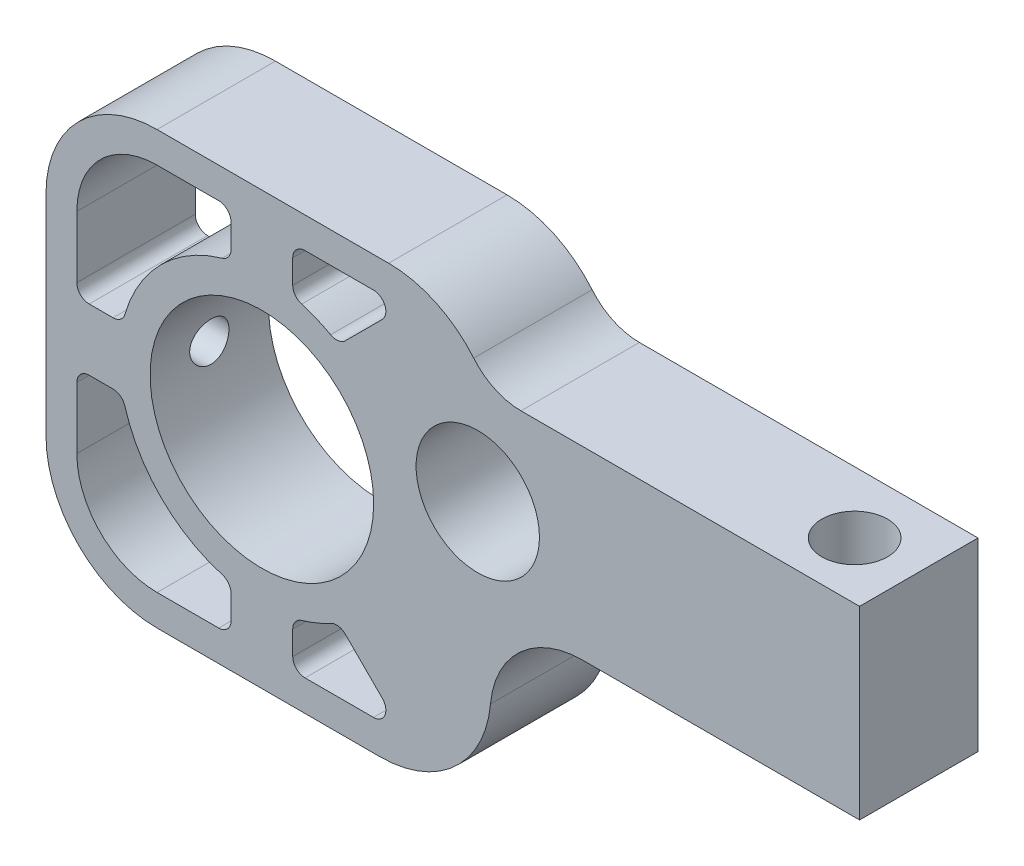
from build123d import *

# Parameters (mm, degrees)
SKETCH1_W               = 96.52
SKETCH1_H               = 44.45
BOSS_EXTRUDE1_DEPTH     = 6.096
CUT_EXTRUDE1_REACH      = 108.961
SKETCH2_R               = 11.50874
CUT_EXTRUDE2_REACH      = 108.438
SKETCH3_R               = 3.3782
CUT_EXTRUDE3_REACH      = 108.961
SKETCH7_W               = 12.7635
SKETCH7_H               = 12.192
CUT_EXTRUDE5_DEPTH      = 104.946532487
FILLET1_R               = 11.43
CUT_EXTRUDE9_REACH      = 97.016
CUT_EXTRUDE9_END_RADIUS = 11.50874
SKETCH11_R              = 2.0193
SKETCH12_R              = 6.35
CUT_EXTRUDE10_DEPTH     = 96.601248341


with BuildPart() as part:
    # Sketch1 → Boss-Extrude1 (new, symmetric)
    with BuildSketch(Plane.XY):
        with Locations((48.26, -22.225)):
            Rectangle(SKETCH1_W, SKETCH1_H)
    extrude(amount=BOSS_EXTRUDE1_DEPTH, both=True)

    # Sketch2 → Cut-Extrude1 (cut, up to next)
    with BuildSketch(Plane.XY.offset(6.096), mode=Mode.PRIVATE) as cut_extrude1_sk1:
        with Locations((22.225, -22.225)):
            Circle(SKETCH2_R)
    cut_extrude1_tool1 = extrude(cut_extrude1_sk1.sketch, amount=-CUT_EXTRUDE1_REACH, mode=Mode.PRIVATE) & part.part
    add(cut_extrude1_tool1.solids().sort_by_distance((22.225, -22.225, 6.096))[0], mode=Mode.SUBTRACT)

    # Sketch3 → Cut-Extrude2 (cut, up to next)
    with BuildSketch(Plane(origin=(0, 0, 0), x_dir=(1, 0, 0), z_dir=(0, 1, 0)), mode=Mode.PRIVATE) as cut_extrude2_sk1:
        with Locations(Location((77.4065, -0.254, 0), (0, 0, 270))):
            Circle(SKETCH3_R)
    cut_extrude2_tool1 = extrude(cut_extrude2_sk1.sketch, amount=-CUT_EXTRUDE2_REACH, mode=Mode.PRIVATE) & part.part
    add(cut_extrude2_tool1.solids().sort_by_distance((77.4065, 0, 0.254))[0], mode=Mode.SUBTRACT)

    # Sketch4 → Cut-Extrude3 (cut, up to next)
    with BuildSketch(Plane.XY.offset(6.096), mode=Mode.PRIVATE) as cut_extrude3_sk1:
        with BuildLine():
            Line((48.895, 6.35), (96.52, 6.35))
            ThreePointArc((96.52, 6.35), (102.87, 0), (96.52, -6.35))
            Line((96.52, -6.35), (48.895, -6.35))
            ThreePointArc((48.895, -6.35), (42.545, 0), (48.895, 6.35))
        make_face()
    cut_extrude3_tool1 = extrude(cut_extrude3_sk1.sketch, amount=-CUT_EXTRUDE3_REACH, mode=Mode.PRIVATE) & part.part
    # Sketch4 → Cut-Extrude3 (cut, up to next)
    with BuildSketch(Plane.XY.offset(6.096), mode=Mode.PRIVATE) as cut_extrude3_sk2:
        with BuildLine():
            Line((45.72, -34.925), (45.72, -44.45))
            Line((45.72, -44.45), (55.245, -44.45))
            Line((55.245, -44.45), (96.52, -44.45))
            ThreePointArc((96.52, -44.45), (106.045, -34.925), (96.52, -25.4))
            Line((96.52, -25.4), (55.245, -25.4))
            ThreePointArc((55.245, -25.4), (48.509807909, -28.189807909), (45.72, -34.925))
        make_face()
    cut_extrude3_tool2 = extrude(cut_extrude3_sk2.sketch, amount=-CUT_EXTRUDE3_REACH, mode=Mode.PRIVATE) & part.part
    add(cut_extrude3_tool1.solids().sort_by_distance((72.7075, 0, 6.096))[0], mode=Mode.SUBTRACT)
    add(cut_extrude3_tool2.solids().sort_by_distance((75.382091, -35.05704, 6.096))[0], mode=Mode.SUBTRACT)

    # Sketch7 → Cut-Extrude5 (cut, through all)
    with BuildSketch(Plane(origin=(0, -6.35, 0), x_dir=(1, 0, 0), z_dir=(0, 1, 0))):
        with Locations((90.13825, 0)):
            Rectangle(SKETCH7_W, SKETCH7_H)
    extrude(amount=-CUT_EXTRUDE5_DEPTH, mode=Mode.SUBTRACT)

    # Fillet1
    fillet1_edges = [part.edges().sort_by_distance(p)[0] for p in [
        (42.545, 0, 0),
        (45.72, -44.45, 0),
        (0, -44.45, 0),
        (0, 0, 0),
    ]]
    fillet(fillet1_edges, radius=FILLET1_R)

    # Cut-Extrude9: up to this cylinder (the profile starts outside it)
    cut_extrude9_end = Plane(origin=(22.225, -22.225, 0), z_dir=(0, 0, 1)) * Cylinder(CUT_EXTRUDE9_END_RADIUS, 218.04948, mode=Mode.PRIVATE)
    # Sketch11 → Cut-Extrude9 (cut, up to the surface)
    with BuildSketch(Plane.ZY, mode=Mode.PRIVATE) as cut_extrude9_sk1:
        with Locations(Location((0, -22.225, 0), (0, 0, 270))):
            Circle(SKETCH11_R)
    cut_extrude9_tool1 = extrude(cut_extrude9_sk1.sketch, amount=-CUT_EXTRUDE9_REACH, mode=Mode.PRIVATE) - cut_extrude9_end
    add(cut_extrude9_tool1.solids().sort_by_distance((0, -22.225, 0))[0], mode=Mode.SUBTRACT)

    # Sketch12 → Cut-Extrude10 (cut, through all)
    with BuildSketch(Plane.XY.offset(6.096)):
        with Locations((44.45, -16.66875)):
            Circle(SKETCH12_R)
        with BuildLine():
            Line((17.78, -3.175), (11.43, -3.175))
            ThreePointArc((11.43, -3.175), (5.592833521, -5.592833521), (3.175, -11.43))
            Line((3.175, -11.43), (3.175, -17.78))
            ThreePointArc((3.175, -17.78), (3.546974388, -18.678025612), (4.445, -19.05))
            Line((4.445, -19.05), (6.902996378, -19.05))
            ThreePointArc((6.902996378, -19.05), (7.665727307, -18.795451392), (8.122706904, -18.133844929))
            ThreePointArc((8.122706904, -18.133844929), (11.842027873, -11.842027873), (18.133844929, -8.122706904))
            ThreePointArc((18.133844929, -8.122706904), (18.795451392, -7.665727307), (19.05, -6.902996378))
            Line((19.05, -6.902996378), (19.05, -4.445))
            ThreePointArc((19.05, -4.445), (18.678025612, -3.546974388), (17.78, -3.175))
        make_face()
        with BuildLine():
            Line((26.67, -41.275), (33.718820715, -41.275))
            ThreePointArc((33.718820715, -41.275), (34.892147722, -40.491007959), (34.616846327, -39.106974388))
            Line((34.616846327, -39.106974388), (30.814228632, -35.304356693))
            ThreePointArc((30.814228632, -35.304356693), (30.094903373, -34.945017527), (29.303943585, -35.089710572))
            ThreePointArc((29.303943585, -35.089710572), (27.844224023, -35.791006847), (26.316155071, -36.327293096))
            ThreePointArc((26.316155071, -36.327293096), (25.654548608, -36.784272693), (25.4, -37.547003622))
            Line((25.4, -37.547003622), (25.4, -40.005))
            ThreePointArc((25.4, -40.005), (25.771974388, -40.903025612), (26.67, -41.275))
        make_face()
        with BuildLine():
            Line((34.616846327, -5.343025612), (30.814228632, -9.145643307))
            ThreePointArc((30.814228632, -9.145643307), (30.094903373, -9.504982473), (29.303943585, -9.360289428))
            ThreePointArc((29.303943585, -9.360289428), (27.844224023, -8.658993153), (26.316155071, -8.122706904))
            ThreePointArc((26.316155071, -8.122706904), (25.654548608, -7.665727307), (25.4, -6.902996378))
            Line((25.4, -6.902996378), (25.4, -4.445))
            ThreePointArc((25.4, -4.445), (25.771974388, -3.546974388), (26.67, -3.175))
            Line((26.67, -3.175), (33.718820715, -3.175))
            ThreePointArc((33.718820715, -3.175), (34.892147722, -3.958992041), (34.616846327, -5.343025612))
        make_face()
        with BuildLine():
            Line((11.43, -41.275), (17.78, -41.275))
            ThreePointArc((17.78, -41.275), (18.678025612, -40.903025612), (19.05, -40.005))
            Line((19.05, -40.005), (19.05, -37.547003622))
            ThreePointArc((19.05, -37.547003622), (18.795451392, -36.784272693), (18.133844929, -36.327293096))
            ThreePointArc((18.133844929, -36.327293096), (11.842027873, -32.607972127), (8.122706904, -26.316155071))
            ThreePointArc((8.122706904, -26.316155071), (7.665727307, -25.654548608), (6.902996378, -25.4))
            Line((6.902996378, -25.4), (4.445, -25.4))
            ThreePointArc((4.445, -25.4), (3.546974388, -25.771974388), (3.175, -26.67))
            Line((3.175, -26.67), (3.175, -33.02))
            ThreePointArc((3.175, -33.02), (5.592833521, -38.857166479), (11.43, -41.275))
        make_face()
    extrude(amount=-CUT_EXTRUDE10_DEPTH, mode=Mode.SUBTRACT)


solid = part.part
